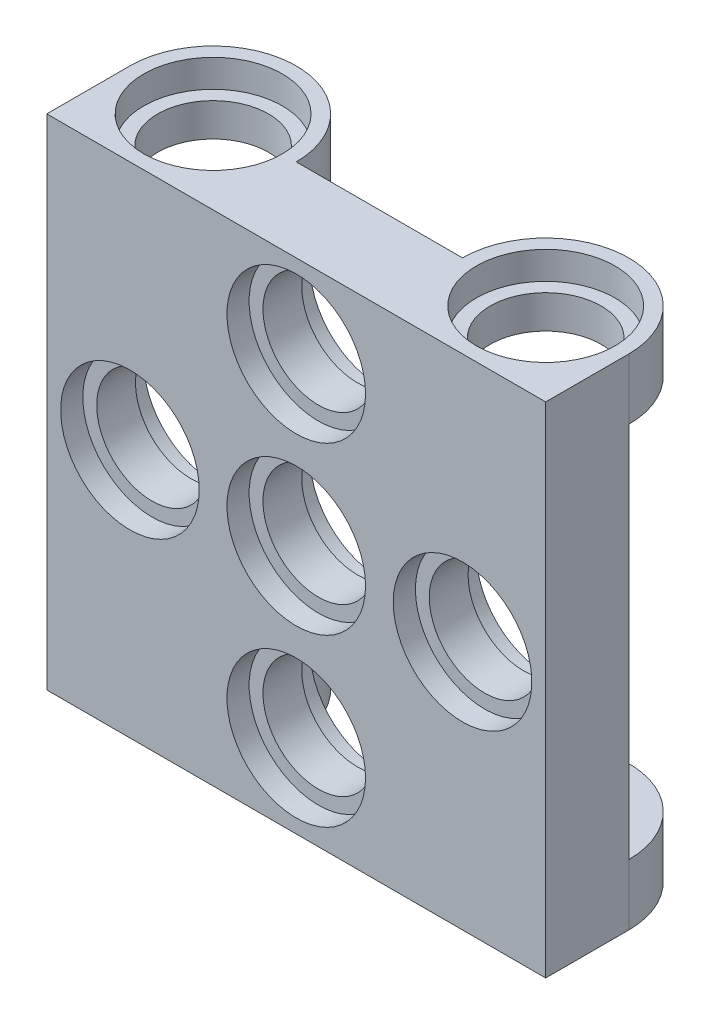
from build123d import *

# Parameters (mm, degrees)
ESQUISSE1_W             = 9
ESQUISSE1_H             = 9
BOSS_EXTRU_1_DEPTH      = 3
PER_AGE1_D              = 4
PER_AGE1_DEPTH          = 3
PER_AGE1_CBORE_D        = 5
PER_AGE1_CBORE_DEPTH    = 0.8
PER_AGE1_TIP            = 1.201721238
BOSS_EXTRU_2_DEPTH      = 2.2
PER_AGE2_D              = 4
PER_AGE2_DEPTH          = 2.2
PER_AGE2_CBORE_D        = 5
PER_AGE2_CBORE_DEPTH    = 1
ESQUISSE7_R             = 2.5
ENL_V_MAT_EXTRU_1_DEPTH = 0.8
ENL_V_START             = -0.8
ESQUISSE8_R             = 2.5
ENL_V_MAT_EXTRU_2_DEPTH = 0.8


with BuildPart() as part:
    # Esquisse1 → Boss.-Extru.1 (new body)
    with BuildSketch(Plane.XY):
        with Locations((-4.5, 4.5)):
            Rectangle(ESQUISSE1_W, ESQUISSE1_H)
    extrude(amount=BOSS_EXTRU_1_DEPTH)

    # Perçage1
    with Locations(Plane.XY.offset(3)):
        with Locations((0, 0), (0, 6), (-6, 0)):
            CounterBoreHole(PER_AGE1_D / 2, PER_AGE1_CBORE_D / 2, PER_AGE1_CBORE_DEPTH, depth=PER_AGE1_DEPTH)
            with Locations((0, 0, -(PER_AGE1_DEPTH + PER_AGE1_TIP / 2))):  # 118° drill point
                Cone(0, PER_AGE1_D / 2, PER_AGE1_TIP, mode=Mode.SUBTRACT)

    # Esquisse4 → Boss.-Extru.2 (add)
    with BuildSketch(Plane(origin=(0, 9, 0), x_dir=(1, 0, 0), z_dir=(0, 1, 0))):
        with BuildLine():
            Line((-9, 0), (-3, 0))
            ThreePointArc((-3, 0), (-6, 3), (-9, 0))
        make_face()
    extrude(amount=-BOSS_EXTRU_2_DEPTH)

    # Perçage2
    with Locations(Plane(origin=(0, 9, 0), x_dir=(1, 0, 0), z_dir=(0, 1, 0))):
        with Locations((-6, 0)):
            CounterBoreHole(PER_AGE2_D / 2, PER_AGE2_CBORE_D / 2, PER_AGE2_CBORE_DEPTH, depth=PER_AGE2_DEPTH)

    # Esquisse7 → Enlèv. mat.-Extru.1 (cut)
    with BuildSketch(Plane.XZ.offset(-6.8)):
        with Locations(Location((-6, 0, 0), (0, 0, 90))):
            Circle(ESQUISSE7_R)
    extrude(amount=ENL_V_MAT_EXTRU_1_DEPTH, mode=Mode.SUBTRACT)

    # Esquisse8 → Enlèv. mat.-Extru.2 (cut)
    with BuildSketch(Plane(origin=(0, 0, 0), x_dir=(-1, 0, 0), z_dir=(0, 0, -1)).offset(ENL_V_START)):
        Circle(ESQUISSE8_R)
        with Locations((6, 0)):
            Circle(ESQUISSE8_R)
        with Locations((0, 6)):
            Circle(ESQUISSE8_R)
    extrude(amount=ENL_V_MAT_EXTRU_2_DEPTH, mode=Mode.SUBTRACT)

    # Symétrie4: part across plane


with BuildPart() as part_1:
    add(part.part)
    add(part.part.mirror(Plane(origin=(0, 0, 0), x_dir=(0, 0, 1), z_dir=(1, 0, 0))))

    # Symétrie5: part across plane


with BuildPart() as part_2:
    add(part_1.part)
    add(part_1.part.mirror(Plane.ZX))


solid = part_2.part
